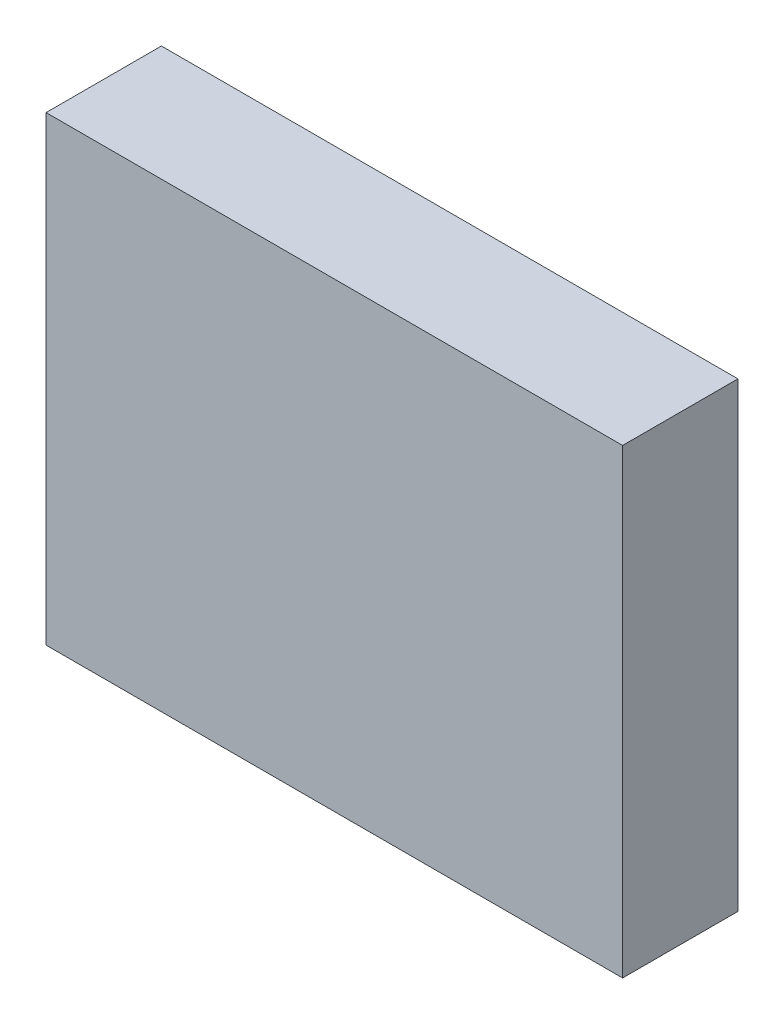
from build123d import *

# Parameters (mm, degrees)
SKETCH1_W           = 500
SKETCH1_H           = 400
BOSS_EXTRUDE1_DEPTH = 100


with BuildPart() as part:
    # Sketch1 → Boss-Extrude1 (new body)
    with BuildSketch(Plane.XY):
        with Locations((250, -200)):
            Rectangle(SKETCH1_W, SKETCH1_H)
    extrude(amount=BOSS_EXTRUDE1_DEPTH)


solid = part.part
